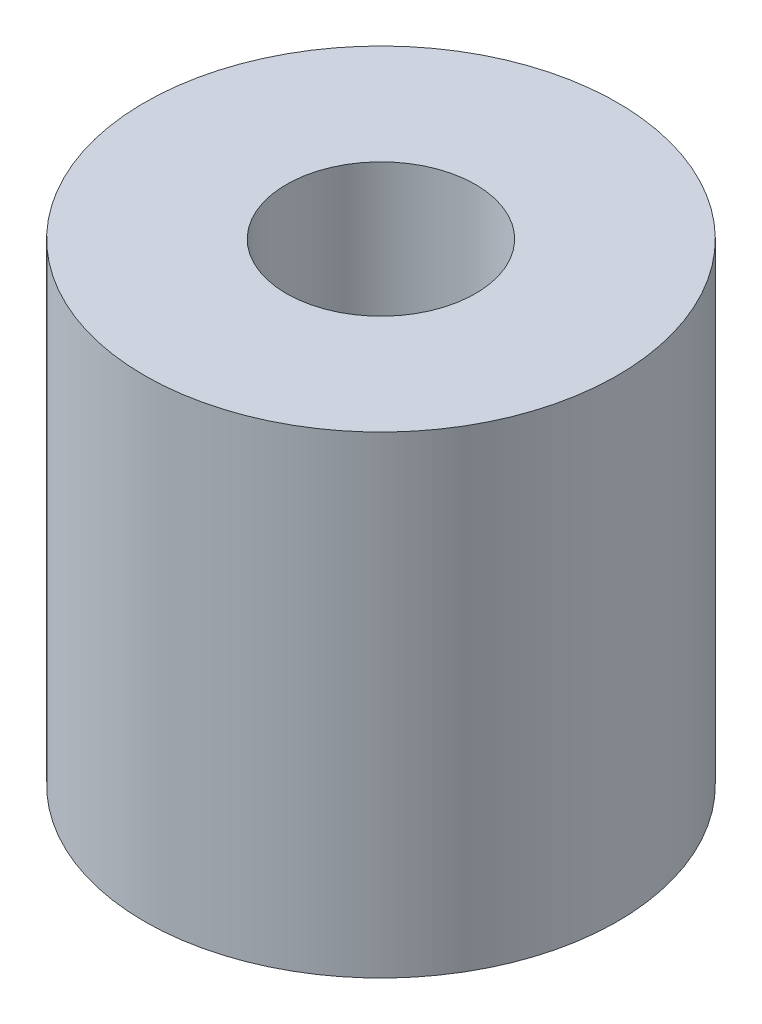
from build123d import *

# Parameters (mm, degrees)
SKETCH1_R           = 5
SKETCH1_R_2         = 2
BOSS_EXTRUDE1_DEPTH = 10


with BuildPart() as part:
    # Sketch1 → Boss-Extrude1 (new body)
    with BuildSketch(Plane(origin=(0, 0, 0), x_dir=(1, 0, 0), z_dir=(0, 1, 0))):
        with Locations(Location((0, 0, 0), (0, 0, 270))):
            Circle(SKETCH1_R)
        with Locations(Location((0, 0, 0), (0, 0, 270))):
            Circle(SKETCH1_R_2, mode=Mode.SUBTRACT)
    extrude(amount=BOSS_EXTRUDE1_DEPTH)


solid = part.part
